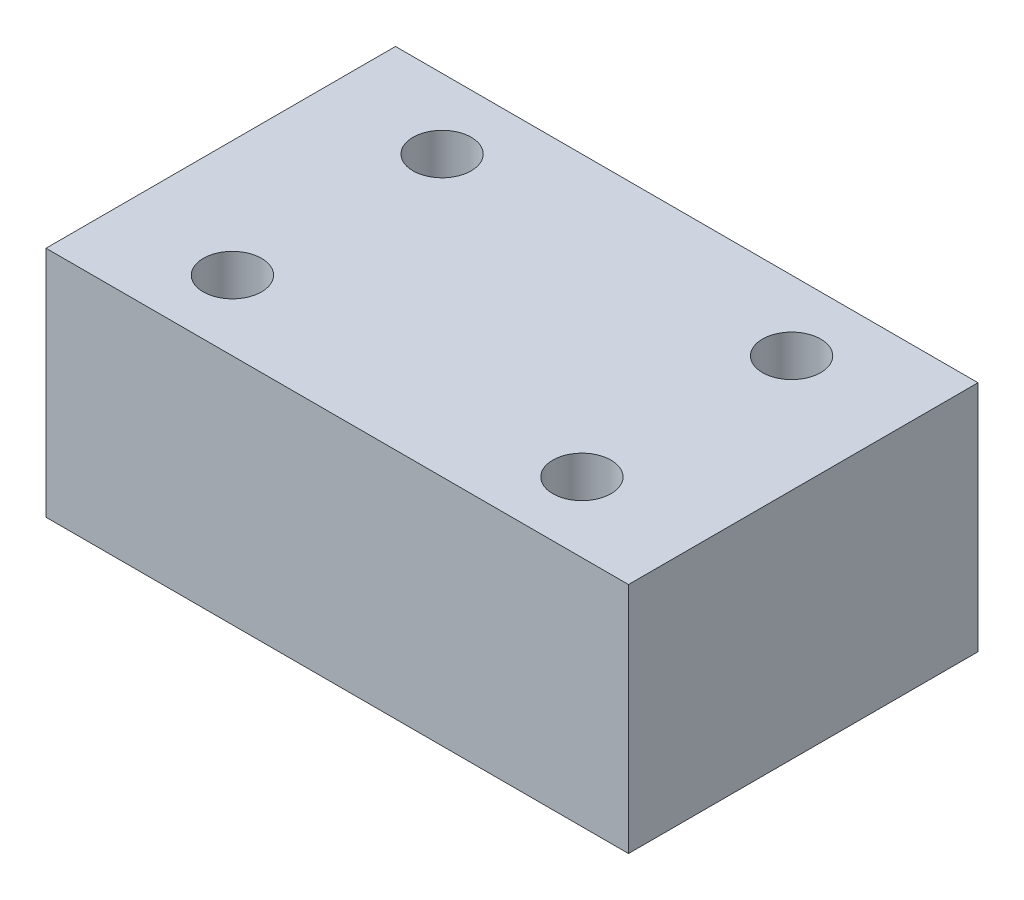
from build123d import *

# Parameters (mm, degrees)
SKETCH_1_W          = 250
SKETCH_1_H          = 150
EXTRUDE_2_DEPTH     = 100
SKETCH_3_R          = 12.5
CUT_EXTRUDE_1_DEPTH = 20


with BuildPart() as part:
    # 草图1 → 凸台-拉伸2 (new body)
    with BuildSketch(Plane(origin=(0, 0, 0), x_dir=(1, 0, 0), z_dir=(0, 1, 0))):
        Rectangle(SKETCH_1_W, SKETCH_1_H)
    extrude(amount=EXTRUDE_2_DEPTH)

    # 草图3 → 切除-拉伸1 (cut)
    with BuildSketch(Plane(origin=(0, 100, 0), x_dir=(1, 0, 0), z_dir=(0, 1, 0))):
        with Locations(Location((-75, 45, 0), (0, 0, 270))):
            Circle(SKETCH_3_R)
        with Locations(Location((75, 45, 0), (0, 0, 270))):
            Circle(SKETCH_3_R)
        with Locations(Location((75, -45, 0), (0, 0, 270))):
            Circle(SKETCH_3_R)
        with Locations(Location((-75, -45, 0), (0, 0, 270))):
            Circle(SKETCH_3_R)
    extrude(amount=-CUT_EXTRUDE_1_DEPTH, mode=Mode.SUBTRACT)


solid = part.part
